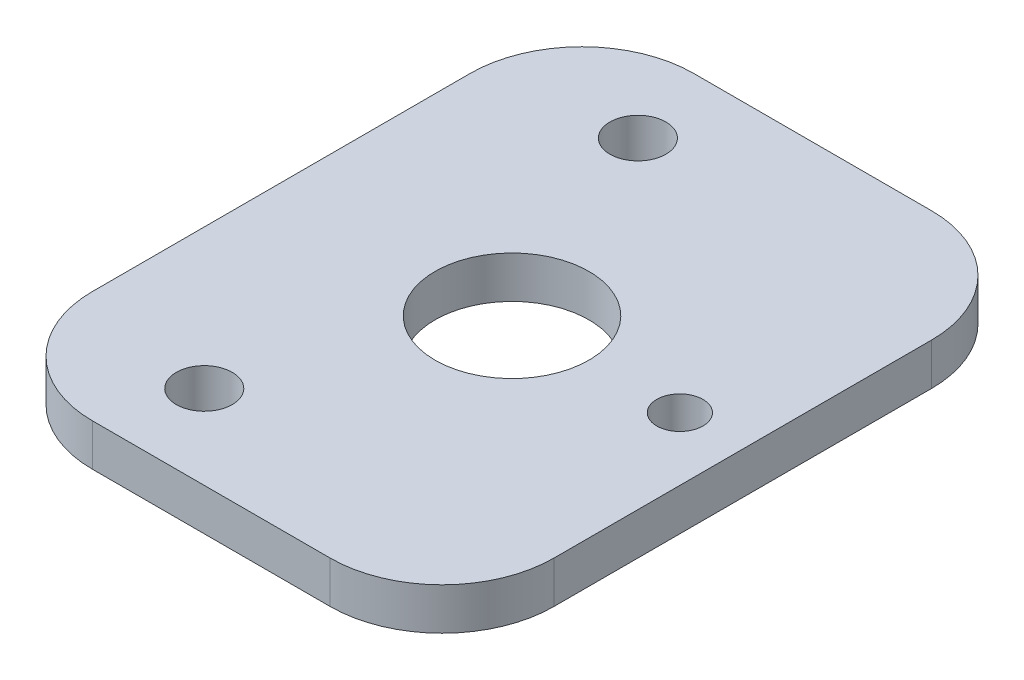
from build123d import *

# Parameters (mm, degrees)
SKETCH1_W           = 33
SKETCH1_H           = 43
SKETCH1_R           = 5.5
BOSS_EXTRUDE1_DEPTH = 3
SKETCH2_R           = 2
SKETCH2_R_2         = 1.65
CUT_EXTRUDE1_DEPTH  = 10
FILLET1_R           = 8


with BuildPart() as part:
    # Sketch1 → Boss-Extrude1 (new body)
    with BuildSketch(Plane(origin=(0, 0, 0), x_dir=(1, 0, 0), z_dir=(0, 1, 0))):
        Rectangle(SKETCH1_W, SKETCH1_H)
        with Locations(Location((0, 0, 0), (0, 0, 270))):
            Circle(SKETCH1_R, mode=Mode.SUBTRACT)
    extrude(amount=BOSS_EXTRUDE1_DEPTH)

    # Sketch2 → Cut-Extrude1 (cut)
    with BuildSketch(Plane(origin=(0, 3, 0), x_dir=(1, 0, 0), z_dir=(0, 1, 0))):
        with Locations(Location((-6.5, 15.5, 0), (0, 0, 270))):
            Circle(SKETCH2_R)
        with Locations(Location((-6.5, -15.5, 0), (0, 0, 270))):
            Circle(SKETCH2_R)
        with Locations(Location((12, 0, 0), (0, 0, 270))):
            Circle(SKETCH2_R_2)
    extrude(amount=-CUT_EXTRUDE1_DEPTH, mode=Mode.SUBTRACT)

    # Fillet1
    fillet1_edges = [part.edges().sort_by_distance(p)[0] for p in [
        (16.5, 1.5, 21.5),
        (-16.5, 1.5, 21.5),
        (-16.5, 1.5, -21.5),
        (16.5, 1.5, -21.5),
    ]]
    fillet(fillet1_edges, radius=FILLET1_R)


solid = part.part
